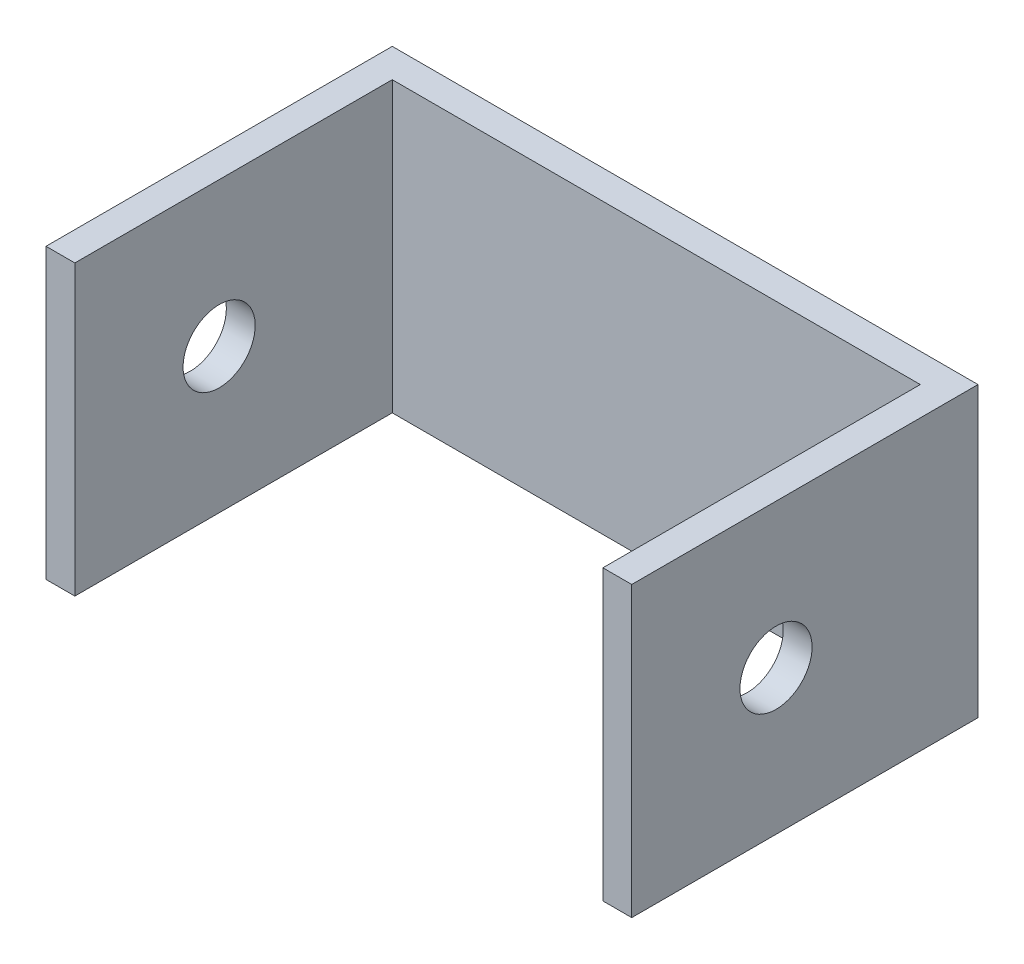
from build123d import *

# Parameters (mm, degrees)
SKETCH_1_W          = 40.6
SKETCH_1_H          = 20
EXTRUDE_1_DEPTH     = 2
SKETCH_2_W          = 2
SKETCH_2_H          = 20
EXTRUDE_2_DEPTH     = 22
SKETCH_3_R          = 2.5
CUT_EXTRUDE_1_DEPTH = 49.211616857


with BuildPart() as part:
    # 草图1 → 凸台-拉伸1 (new body)
    with BuildSketch(Plane.XY):
        Rectangle(SKETCH_1_W, SKETCH_1_H)
    extrude(amount=EXTRUDE_1_DEPTH)

    # 草图2 → 凸台-拉伸2 (add)
    with BuildSketch(Plane.XY.offset(2)):
        with Locations((-19.3, 0)):
            Rectangle(SKETCH_2_W, SKETCH_2_H)
        with Locations((19.3, 0)):
            Rectangle(SKETCH_2_W, SKETCH_2_H)
    extrude(amount=EXTRUDE_2_DEPTH)

    # 草图3 → 切除-拉伸1 (cut, through all)
    with BuildSketch(Plane.ZY.offset(20.3)):
        with Locations(Location((14, 0, 0), (0, 0, 270))):
            Circle(SKETCH_3_R)
    extrude(amount=-CUT_EXTRUDE_1_DEPTH, mode=Mode.SUBTRACT)


solid = part.part
